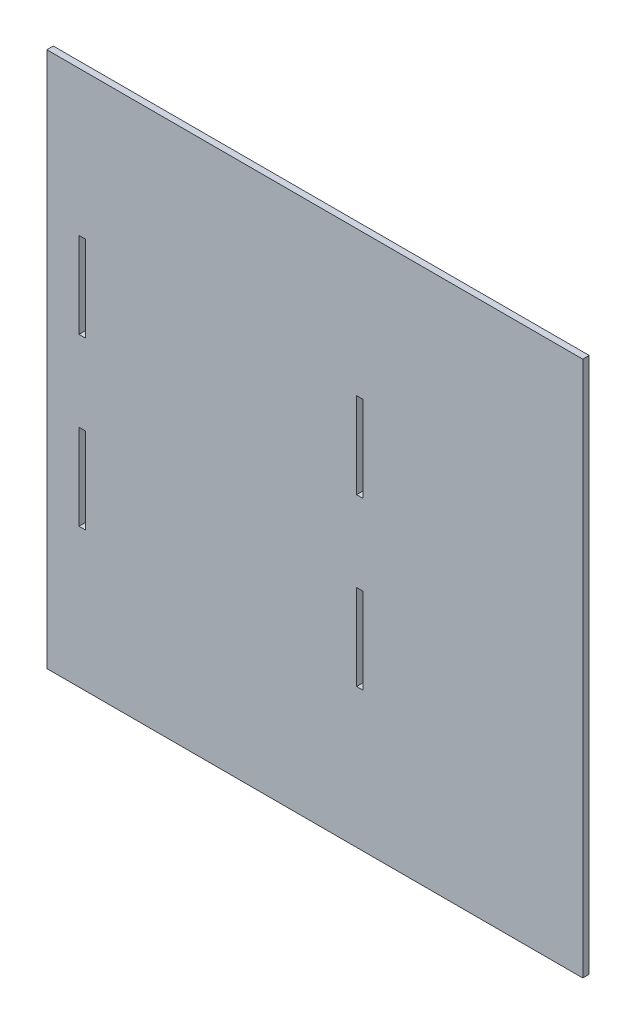
from build123d import *

# Parameters (mm, degrees)
ESBO_O1_W                = 500
ESBO_O1_H                = 500
ESBO_O1_W_2              = 6
ESBO_O1_H_2              = 80
RESSALTO_EXTRUS_O1_DEPTH = 6


with BuildPart() as part:
    # Esboço1 → Ressalto-extrusão1 (new body)
    with BuildSketch(Plane.XY):
        with Locations((250, 250)):
            Rectangle(ESBO_O1_W, ESBO_O1_H)
        with Locations((33, 170)):
            Rectangle(ESBO_O1_W_2, ESBO_O1_H_2, mode=Mode.SUBTRACT)
        with Locations((33, 325)):
            Rectangle(ESBO_O1_W_2, ESBO_O1_H_2, mode=Mode.SUBTRACT)
        with Locations((292, 325)):
            Rectangle(ESBO_O1_W_2, ESBO_O1_H_2, mode=Mode.SUBTRACT)
        with Locations((292, 170)):
            Rectangle(ESBO_O1_W_2, ESBO_O1_H_2, mode=Mode.SUBTRACT)
    extrude(amount=RESSALTO_EXTRUS_O1_DEPTH)


solid = part.part
